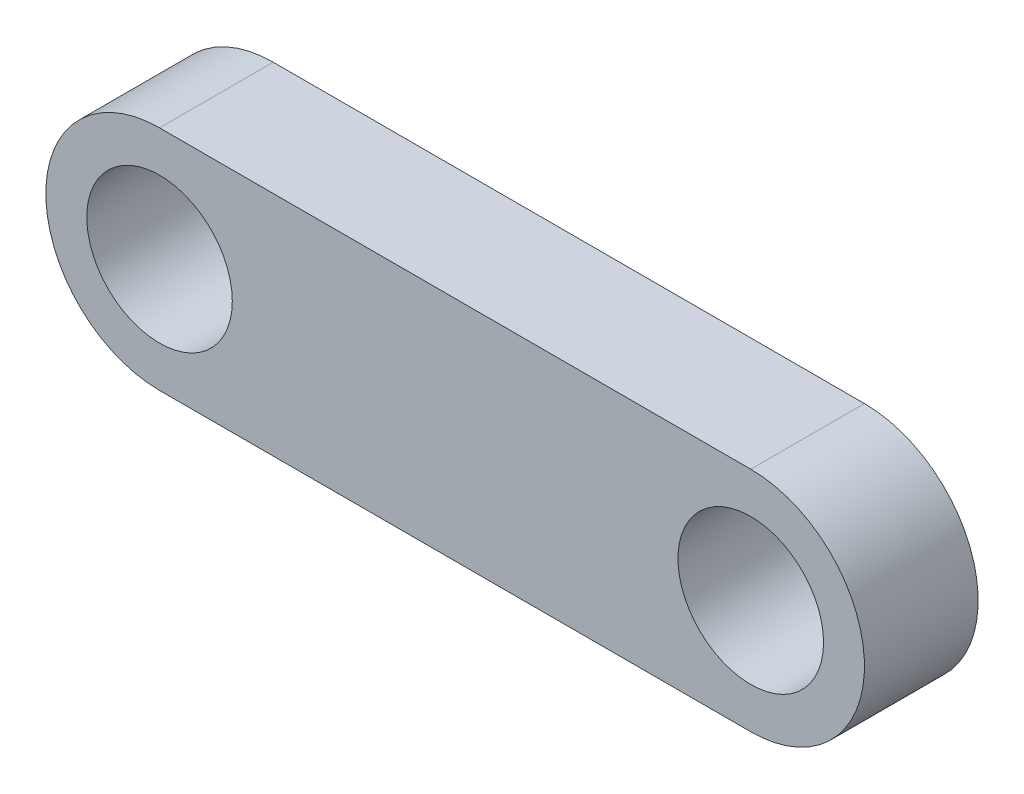
from build123d import *

# Parameters (mm, degrees)
SKETCH_1_R      = 1.6
EXTRUDE_2_DEPTH = 2.5
SKETCH_2_R      = 1.6
EXTRUDE_4_DEPTH = 2.5


with BuildPart() as part:
    # 草图1 → 凸台-拉伸2 (new body)
    with BuildSketch(Plane.XY):
        with BuildLine():
            Line((-4.793926247, 2), (8.206073753, 2))
            ThreePointArc((8.206073753, 2), (10.206073753, 0), (8.206073753, -2))
            Line((8.206073753, -2), (-4.793926247, -2))
            ThreePointArc((-4.793926247, -2), (-6.793926247, 0), (-4.793926247, 2))
        make_face()
        with Locations((-4.793926247, 0)):
            Circle(SKETCH_1_R, mode=Mode.SUBTRACT)
        with Locations((8.206073753, 0)):
            Circle(SKETCH_1_R, mode=Mode.SUBTRACT)
    extrude(amount=EXTRUDE_2_DEPTH)

    # 草图2 → 凸台-拉伸4 (add)
    with BuildSketch(Plane(origin=(0, 0, 0), x_dir=(-1, 0, 0), z_dir=(0, 0, -1))):
        with BuildLine():
            Line((-8.206073753, 2.5), (4.793926247, 2.5))
            ThreePointArc((4.793926247, 2.5), (7.293926247, 0), (4.793926247, -2.5))
            Line((4.793926247, -2.5), (-8.206073753, -2.5))
            ThreePointArc((-8.206073753, -2.5), (-10.706073753, 0), (-8.206073753, 2.5))
        make_face()
        with Locations(Location((4.793926247, 0, 0), (0, 0, 180))):
            Circle(SKETCH_2_R, mode=Mode.SUBTRACT)
        with Locations(Location((-8.206073753, 0, 0), (0, 0, 180))):
            Circle(SKETCH_2_R, mode=Mode.SUBTRACT)
    extrude(amount=-EXTRUDE_4_DEPTH)


solid = part.part
